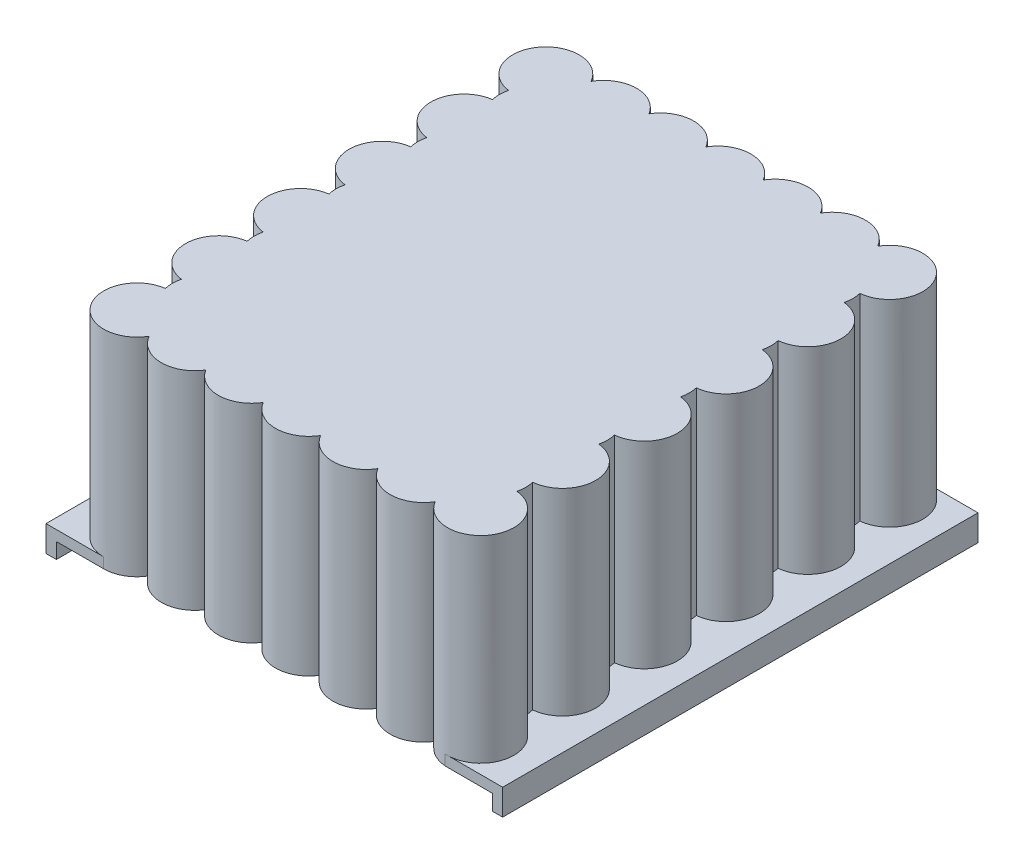
from build123d import *

# Parameters (mm, degrees)
SKETCH3_W           = 266.7
SKETCH3_H           = 304.8
BOSS_EXTRUDE1_DEPTH = 127
SKETCH2_R           = 14
CUT_EXTRUDE1_DEPTH  = 101.6
SKETCH5_W           = 266.7
SKETCH5_H           = 304.8
CUT_EXTRUDE2_DEPTH  = 240.858842452
BOSS_EXTRUDE2_DEPTH = 6.35
SKETCH10_W          = 6.35
SKETCH10_H          = 290.83
BOSS_EXTRUDE5_DEPTH = 9.525


with BuildPart() as part:
    # Sketch3 → Boss-Extrude1 (new body)
    with BuildSketch(Plane(origin=(0, 0, 0), x_dir=(1, 0, 0), z_dir=(0, 1, 0))):
        with Locations((1.030211855, 0.391436162)):
            Rectangle(SKETCH3_W, SKETCH3_H)
    extrude(amount=BOSS_EXTRUDE1_DEPTH)

    # Sketch2 → Cut-Extrude1 (cut)
    with BuildSketch(Plane(origin=(0, 0, 0), x_dir=(1, 0, 0), z_dir=(0, 1, 0))):
        with Locations(Location((-104.384517455, 125.341266146, 0), (0, 0, 270))):
            Circle(SKETCH2_R)
        with Locations(Location((-69.384517455, 125.341266146, 0), (0, 0, 270))):
            Circle(SKETCH2_R)
        with Locations(Location((-34.384517455, 125.341266146, 0), (0, 0, 270))):
            Circle(SKETCH2_R)
        with Locations(Location((0.615482545, 125.341266146, 0), (0, 0, 270))):
            Circle(SKETCH2_R)
        with Locations(Location((35.615482545, 125.341266146, 0), (0, 0, 270))):
            Circle(SKETCH2_R)
        with Locations(Location((70.615482545, 125.341266146, 0), (0, 0, 270))):
            Circle(SKETCH2_R)
        with Locations(Location((105.615482545, 125.341266146, 0), (0, 0, 270))):
            Circle(SKETCH2_R)
        with Locations(Location((-69.384517455, 75.341266146, 0), (0, 0, 270))):
            Circle(SKETCH2_R)
        with Locations(Location((-34.384517455, 75.341266146, 0), (0, 0, 270))):
            Circle(SKETCH2_R)
        with Locations(Location((0.615482545, 75.341266146, 0), (0, 0, 270))):
            Circle(SKETCH2_R)
        with Locations(Location((35.615482545, 75.341266146, 0), (0, 0, 270))):
            Circle(SKETCH2_R)
        with Locations(Location((70.615482545, 75.341266146, 0), (0, 0, 270))):
            Circle(SKETCH2_R)
        with Locations(Location((105.615482545, 75.341266146, 0), (0, 0, 270))):
            Circle(SKETCH2_R)
        with Locations(Location((-69.384517455, 25.341266146, 0), (0, 0, 270))):
            Circle(SKETCH2_R)
        with Locations(Location((-34.384517455, 25.341266146, 0), (0, 0, 270))):
            Circle(SKETCH2_R)
        with Locations(Location((0.615482545, 25.341266146, 0), (0, 0, 270))):
            Circle(SKETCH2_R)
        with Locations(Location((35.615482545, 25.341266146, 0), (0, 0, 270))):
            Circle(SKETCH2_R)
        with Locations(Location((70.615482545, 25.341266146, 0), (0, 0, 270))):
            Circle(SKETCH2_R)
        with Locations(Location((105.615482545, 25.341266146, 0), (0, 0, 270))):
            Circle(SKETCH2_R)
        with Locations(Location((-69.384517455, -24.658733854, 0), (0, 0, 270))):
            Circle(SKETCH2_R)
        with Locations(Location((-34.384517455, -24.658733854, 0), (0, 0, 270))):
            Circle(SKETCH2_R)
        with Locations(Location((0.615482545, -24.658733854, 0), (0, 0, 270))):
            Circle(SKETCH2_R)
        with Locations(Location((35.615482545, -24.658733854, 0), (0, 0, 270))):
            Circle(SKETCH2_R)
        with Locations(Location((70.615482545, -24.658733854, 0), (0, 0, 270))):
            Circle(SKETCH2_R)
        with Locations(Location((105.615482545, -24.658733854, 0), (0, 0, 270))):
            Circle(SKETCH2_R)
        with Locations(Location((-69.384517455, -74.658733854, 0), (0, 0, 270))):
            Circle(SKETCH2_R)
        with Locations(Location((-34.384517455, -74.658733854, 0), (0, 0, 270))):
            Circle(SKETCH2_R)
        with Locations(Location((0.615482545, -74.658733854, 0), (0, 0, 270))):
            Circle(SKETCH2_R)
        with Locations(Location((35.615482545, -74.658733854, 0), (0, 0, 270))):
            Circle(SKETCH2_R)
        with Locations(Location((70.615482545, -74.658733854, 0), (0, 0, 270))):
            Circle(SKETCH2_R)
        with Locations(Location((105.615482545, -74.658733854, 0), (0, 0, 270))):
            Circle(SKETCH2_R)
        with Locations(Location((-69.384517455, -124.658733854, 0), (0, 0, 270))):
            Circle(SKETCH2_R)
        with Locations(Location((-34.384517455, -124.658733854, 0), (0, 0, 270))):
            Circle(SKETCH2_R)
        with Locations(Location((0.615482545, -124.658733854, 0), (0, 0, 270))):
            Circle(SKETCH2_R)
        with Locations(Location((35.615482545, -124.658733854, 0), (0, 0, 270))):
            Circle(SKETCH2_R)
        with Locations(Location((70.615482545, -124.658733854, 0), (0, 0, 270))):
            Circle(SKETCH2_R)
        with Locations(Location((105.615482545, -124.658733854, 0), (0, 0, 270))):
            Circle(SKETCH2_R)
        with Locations(Location((-104.384517455, 75.341266146, 0), (0, 0, 270))):
            Circle(SKETCH2_R)
        with Locations(Location((-104.384517455, 25.341266146, 0), (0, 0, 270))):
            Circle(SKETCH2_R)
        with Locations(Location((-104.384517455, -24.658733854, 0), (0, 0, 270))):
            Circle(SKETCH2_R)
        with Locations(Location((-104.384517455, -74.658733854, 0), (0, 0, 270))):
            Circle(SKETCH2_R)
        with Locations(Location((-104.384517455, -124.658733854, 0), (0, 0, 270))):
            Circle(SKETCH2_R)
        with Locations(Location((-87.384517455, 100.341266146, 0), (0, 0, 270))):
            Circle(SKETCH2_R)
        with Locations(Location((-52.384517455, 100.341266146, 0), (0, 0, 270))):
            Circle(SKETCH2_R)
        with Locations(Location((-17.384517455, 100.341266146, 0), (0, 0, 270))):
            Circle(SKETCH2_R)
        with Locations(Location((17.615482545, 100.341266146, 0), (0, 0, 270))):
            Circle(SKETCH2_R)
        with Locations(Location((52.615482545, 100.341266146, 0), (0, 0, 270))):
            Circle(SKETCH2_R)
        with Locations(Location((87.615482545, 100.341266146, 0), (0, 0, 270))):
            Circle(SKETCH2_R)
        with Locations(Location((-52.384517455, 50.341266146, 0), (0, 0, 270))):
            Circle(SKETCH2_R)
        with Locations(Location((-17.384517455, 50.341266146, 0), (0, 0, 270))):
            Circle(SKETCH2_R)
        with Locations(Location((17.615482545, 50.341266146, 0), (0, 0, 270))):
            Circle(SKETCH2_R)
        with Locations(Location((52.615482545, 50.341266146, 0), (0, 0, 270))):
            Circle(SKETCH2_R)
        with Locations(Location((87.615482545, 50.341266146, 0), (0, 0, 270))):
            Circle(SKETCH2_R)
        with Locations(Location((-52.384517455, 0.341266146, 0), (0, 0, 270))):
            Circle(SKETCH2_R)
        with Locations(Location((-17.384517455, 0.341266146, 0), (0, 0, 270))):
            Circle(SKETCH2_R)
        with Locations(Location((17.615482545, 0.341266146, 0), (0, 0, 270))):
            Circle(SKETCH2_R)
        with Locations(Location((52.615482545, 0.341266146, 0), (0, 0, 270))):
            Circle(SKETCH2_R)
        with Locations(Location((87.615482545, 0.341266146, 0), (0, 0, 270))):
            Circle(SKETCH2_R)
        with Locations(Location((-52.384517455, -49.658733854, 0), (0, 0, 270))):
            Circle(SKETCH2_R)
        with Locations(Location((-17.384517455, -49.658733854, 0), (0, 0, 270))):
            Circle(SKETCH2_R)
        with Locations(Location((17.615482545, -49.658733854, 0), (0, 0, 270))):
            Circle(SKETCH2_R)
        with Locations(Location((52.615482545, -49.658733854, 0), (0, 0, 270))):
            Circle(SKETCH2_R)
        with Locations(Location((87.615482545, -49.658733854, 0), (0, 0, 270))):
            Circle(SKETCH2_R)
        with Locations(Location((-52.384517455, -99.658733854, 0), (0, 0, 270))):
            Circle(SKETCH2_R)
        with Locations(Location((-17.384517455, -99.658733854, 0), (0, 0, 270))):
            Circle(SKETCH2_R)
        with Locations(Location((17.615482545, -99.658733854, 0), (0, 0, 270))):
            Circle(SKETCH2_R)
        with Locations(Location((52.615482545, -99.658733854, 0), (0, 0, 270))):
            Circle(SKETCH2_R)
        with Locations(Location((87.615482545, -99.658733854, 0), (0, 0, 270))):
            Circle(SKETCH2_R)
        with Locations(Location((-87.384517455, 50.341266146, 0), (0, 0, 270))):
            Circle(SKETCH2_R)
        with Locations(Location((-87.384517455, 0.341266146, 0), (0, 0, 270))):
            Circle(SKETCH2_R)
        with Locations(Location((-87.384517455, -49.658733854, 0), (0, 0, 270))):
            Circle(SKETCH2_R)
        with Locations(Location((-87.384517455, -99.658733854, 0), (0, 0, 270))):
            Circle(SKETCH2_R)
    extrude(amount=CUT_EXTRUDE1_DEPTH, mode=Mode.SUBTRACT)

    # Sketch5 → Cut-Extrude2 (cut, through all)
    with BuildSketch(Plane.XZ):
        with Locations((1.030211855, -0.391436162)):
            Rectangle(SKETCH5_W, SKETCH5_H)
        with BuildLine():
            ThreePointArc((-86.775223532, 134.798515287), (-121.25188109, 135.98986107), (-107.113753094, 104.522853619))
            ThreePointArc((-107.113753094, 104.522853619), (-107.704508629, 99.639794762), (-107.104651694, 94.757845606))
            ThreePointArc((-107.104651694, 94.757845606), (-124.704516936, 74.625326024), (-107.113753094, 54.484853619))
            ThreePointArc((-107.113753094, 54.484853619), (-107.704508629, 49.601794762), (-107.104651694, 44.719845606))
            ThreePointArc((-107.104651694, 44.719845606), (-124.704516936, 24.587326024), (-107.113753094, 4.446853619))
            ThreePointArc((-107.113753094, 4.446853619), (-107.704508629, -0.436205238), (-107.104651694, -5.318154394))
            ThreePointArc((-107.104651694, -5.318154394), (-124.704516936, -25.450673976), (-107.113753094, -45.591146381))
            ThreePointArc((-107.113753094, -45.591146381), (-107.704508629, -50.474205238), (-107.104651694, -55.356154394))
            ThreePointArc((-107.104651694, -55.356154394), (-124.704516936, -75.488673976), (-107.113753094, -95.629146381))
            ThreePointArc((-107.113753094, -95.629146381), (-107.704508629, -100.512205238), (-107.104651694, -105.394154394))
            ThreePointArc((-107.104651694, -105.394154394), (-121.162990751, -136.993605954), (-86.614743522, -135.387103725))
            ThreePointArc((-86.614743522, -135.387103725), (-69.332292243, -145.712785219), (-51.719624887, -135.961027984))
            ThreePointArc((-51.719624887, -135.961027984), (-34.195273648, -145.851087344), (-16.754517455, -135.814345646))
            ThreePointArc((-16.754517455, -135.814345646), (0.771482545, -145.851266146), (18.297482545, -135.814345646))
            ThreePointArc((18.297482545, -135.814345646), (35.823482545, -145.851266146), (53.349482545, -135.814345646))
            ThreePointArc((53.349482545, -135.814345646), (70.875482545, -145.851266146), (88.401482545, -135.814345646))
            ThreePointArc((88.401482545, -135.814345646), (123.036065237, -136.4947874), (107.948012416, -105.311971919))
            ThreePointArc((107.948012416, -105.311971919), (108.527626689, -100.51235477), (107.957030963, -95.711657112))
            ThreePointArc((107.957030963, -95.711657112), (126.247482039, -75.488734313), (107.948012416, -55.273971919))
            ThreePointArc((107.948012416, -55.273971919), (108.527626689, -50.47435477), (107.957030963, -45.673657112))
            ThreePointArc((107.957030963, -45.673657112), (126.247482039, -25.450734313), (107.948012416, -5.235971919))
            ThreePointArc((107.948012416, -5.235971919), (108.527626689, -0.43635477), (107.957030963, 4.364342888))
            ThreePointArc((107.957030963, 4.364342888), (126.247482039, 24.587265687), (107.948012416, 44.802028081))
            ThreePointArc((107.948012416, 44.802028081), (108.527626689, 49.60164523), (107.957030963, 54.402342888))
            ThreePointArc((107.957030963, 54.402342888), (126.247482039, 74.625265687), (107.948012416, 94.840028081))
            ThreePointArc((107.948012416, 94.840028081), (108.527626689, 99.63964523), (107.957030963, 104.440342888))
            ThreePointArc((107.957030963, 104.440342888), (123.03361969, 135.626070448), (88.401482545, 134.941813353))
            ThreePointArc((88.401482545, 134.941813353), (70.875482545, 144.978733854), (53.349482545, 134.941813353))
            ThreePointArc((53.349482545, 134.941813353), (35.823482545, 144.978733854), (18.297482545, 134.941813353))
            ThreePointArc((18.297482545, 134.941813353), (0.771482545, 144.978733854), (-16.754517455, 134.941813353))
            ThreePointArc((-16.754517455, 134.941813353), (-34.037988271, 144.97728645), (-51.556074361, 135.357216624))
            ThreePointArc((-51.556074361, 135.357216624), (-69.32494992, 145.119804961), (-86.775223532, 134.798515287))
        make_face(mode=Mode.SUBTRACT)
    extrude(amount=-CUT_EXTRUDE2_DEPTH, mode=Mode.SUBTRACT)

    # Sketch6 → Boss-Extrude2 (add)
    with BuildSketch(Plane.XZ):
        with BuildLine():
            Line((-104.384517455, 144.978733854), (-139.7, 144.978733854))
            Line((-139.7, 144.978733854), (-139.7, -145.851266146))
            Line((-139.7, -145.851266146), (-104.384517455, -145.851266146))
            ThreePointArc((-104.384517455, -145.851266146), (-124.658743838, -126.894403923), (-107.104651694, -105.394154394))
            ThreePointArc((-107.104651694, -105.394154394), (-107.704508629, -100.512205238), (-107.113753094, -95.629146381))
            ThreePointArc((-107.113753094, -95.629146381), (-124.704516936, -75.488673976), (-107.104651694, -55.356154394))
            ThreePointArc((-107.104651694, -55.356154394), (-107.704508629, -50.474205238), (-107.113753094, -45.591146381))
            ThreePointArc((-107.113753094, -45.591146381), (-124.704516936, -25.450673976), (-107.104651694, -5.318154394))
            ThreePointArc((-107.104651694, -5.318154394), (-107.704508629, -0.436205238), (-107.113753094, 4.446853619))
            ThreePointArc((-107.113753094, 4.446853619), (-124.704516936, 24.587326024), (-107.104651694, 44.719845606))
            ThreePointArc((-107.104651694, 44.719845606), (-107.704508629, 49.601794762), (-107.113753094, 54.484853619))
            ThreePointArc((-107.113753094, 54.484853619), (-124.704516936, 74.625326024), (-107.104651694, 94.757845606))
            ThreePointArc((-107.104651694, 94.757845606), (-107.704508629, 99.639794762), (-107.113753094, 104.522853619))
            ThreePointArc((-107.113753094, 104.522853619), (-124.658435261, 126.026453421), (-104.384517455, 144.978733854))
        make_face()
    boss_extrude2 = extrude(amount=-BOSS_EXTRUDE2_DEPTH)

    # Mirror2: Boss-Extrude2 across plane
    add(boss_extrude2.mirror(Plane(origin=(0, 0, 0), x_dir=(0, 0, 1), z_dir=(1, 0, 0))))

    # Sketch10 → Boss-Extrude5 (add)
    with BuildSketch(Plane.XZ):
        with Locations((-136.525, -0.436266146)):
            Rectangle(SKETCH10_W, SKETCH10_H)
    boss_extrude5 = extrude(amount=BOSS_EXTRUDE5_DEPTH)

    # Mirror3: Boss-Extrude5 across plane
    add(boss_extrude5.mirror(Plane(origin=(0, 0, 0), x_dir=(0, 0, 1), z_dir=(1, 0, 0))))


solid = part.part
